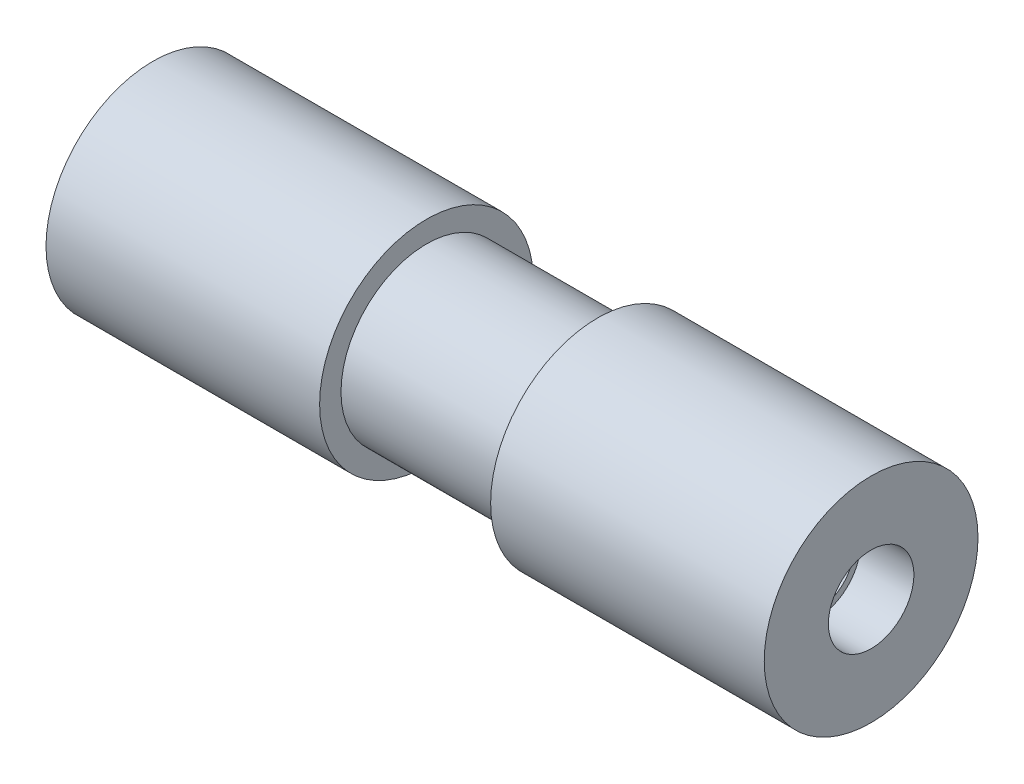
from build123d import *

# Parameters (mm, degrees)
SKETCH1_R           = 31.75
SKETCH1_R_2         = 10.795
BOSS_EXTRUDE1_DEPTH = 106.68
SKETCH2_R           = 12.7
CUT_EXTRUDE1_DEPTH  = 15.875
CUT_EXTRUDE2_START  = -81.28
SKETCH3_OUTSIDE_W   = 111.798
SKETCH3_OUTSIDE_H   = 111.798
SKETCH3_OUTSIDE_R   = 25.4
CUT_EXTRUDE2_DEPTH  = 50.8


with BuildPart() as part:
    # Sketch1 → Boss-Extrude1 (new body)
    with BuildSketch(Plane(origin=(0, 0, 0), x_dir=(0, 0, -1), z_dir=(1, 0, 0))):
        Circle(SKETCH1_R)
        Circle(SKETCH1_R_2, mode=Mode.SUBTRACT)
    boss_extrude1 = extrude(amount=BOSS_EXTRUDE1_DEPTH)

    # Sketch2 → Cut-Extrude1 (cut)
    with BuildSketch(Plane.ZY):
        Circle(SKETCH2_R)
    cut_extrude1 = extrude(amount=-CUT_EXTRUDE1_DEPTH, mode=Mode.SUBTRACT)

    # Mirror1: Boss-Extrude1, Cut-Extrude1 across plane
    add(boss_extrude1.mirror(Plane(origin=(106.68, 0, 0), x_dir=(0, 0, 1), z_dir=(1, 0, 0))))
    add(cut_extrude1.mirror(Plane(origin=(106.68, 0, 0), x_dir=(0, 0, 1), z_dir=(1, 0, 0))), mode=Mode.SUBTRACT)

    # Sketch3 outside → Cut-Extrude2 (cut)
    with BuildSketch(Plane.ZY.offset(CUT_EXTRUDE2_START)):
        Rectangle(SKETCH3_OUTSIDE_W, SKETCH3_OUTSIDE_H)
        Circle(SKETCH3_OUTSIDE_R, mode=Mode.SUBTRACT)
    extrude(amount=-CUT_EXTRUDE2_DEPTH, mode=Mode.SUBTRACT)


solid = part.part
